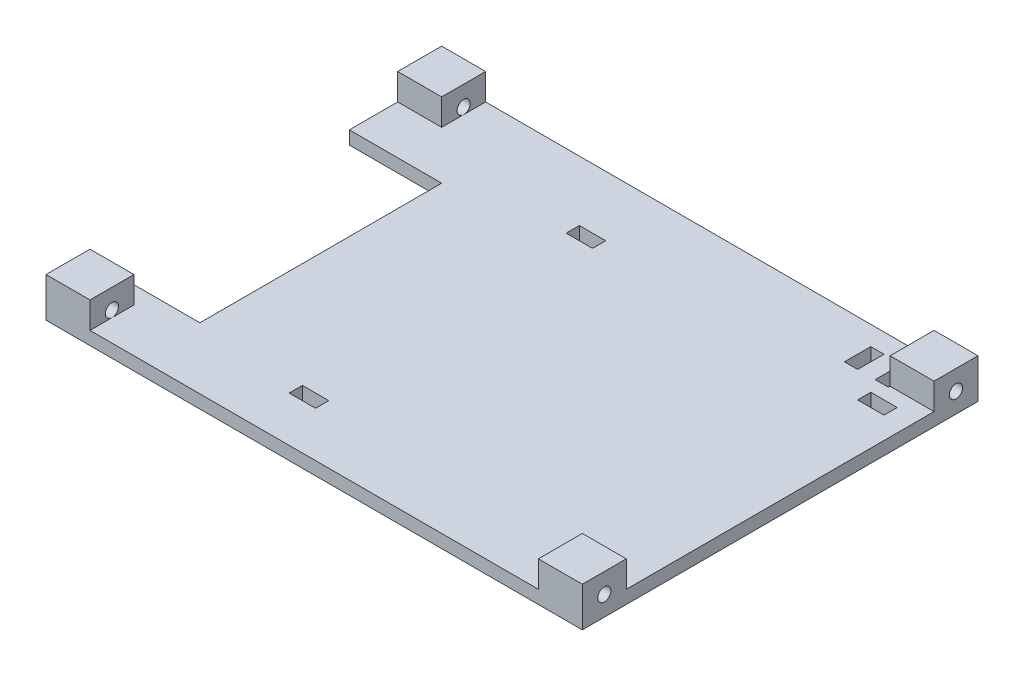
from build123d import *

# Parameters (mm, degrees)
SKETCH1_W           = 122
SKETCH1_H           = 90
BOSS_EXTRUDE1_DEPTH = 3
SKETCH2_W           = 10
SKETCH2_H           = 10
BOSS_EXTRUDE2_DEPTH = 6
CUT_EXTRUDE2_REACH  = 153.872
SKETCH4_R           = 1.5
CUT_EXTRUDE3_REACH  = 153.872
SKETCH5_R           = 1.5
SKETCH7_W           = 6
SKETCH7_H           = 3
SKETCH7_W_2         = 3
SKETCH7_H_2         = 6
SKETCH7_W_3         = 21
SKETCH7_H_3         = 55
CUT_EXTRUDE4_DEPTH  = 152.7234326


with BuildPart() as part:
    # Sketch1 → Boss-Extrude1 (new body)
    with BuildSketch(Plane(origin=(0, 0, 0), x_dir=(1, 0, 0), z_dir=(0, 1, 0))):
        with Locations((61, 45)):
            Rectangle(SKETCH1_W, SKETCH1_H)
    extrude(amount=BOSS_EXTRUDE1_DEPTH)

    # Sketch2 → Boss-Extrude2 (add)
    with BuildSketch(Plane(origin=(0, 3, 0), x_dir=(1, 0, 0), z_dir=(0, 1, 0))):
        Polygon((0, 0), (10, 0), (10, 5.706645394), (10, 10), (7.781127404, 10), (0, 10), align=None)
        with Locations((5, 85)):
            Rectangle(SKETCH2_W, SKETCH2_H)
        with Locations((117, 85)):
            Rectangle(SKETCH2_W, SKETCH2_H)
        with Locations((117, 5)):
            Rectangle(SKETCH2_W, SKETCH2_H)
    extrude(amount=BOSS_EXTRUDE2_DEPTH)

    # Sketch4 → Cut-Extrude2 (cut, up to next)
    with BuildSketch(Plane.ZY, mode=Mode.PRIVATE) as cut_extrude2_sk1:
        with Locations((-85, 4.5)):
            Circle(SKETCH4_R)
    cut_extrude2_tool1 = extrude(cut_extrude2_sk1.sketch, amount=-CUT_EXTRUDE2_REACH, mode=Mode.PRIVATE) & part.part
    # Sketch4 → Cut-Extrude2 (cut, up to next)
    with BuildSketch(Plane.ZY, mode=Mode.PRIVATE) as cut_extrude2_sk2:
        with Locations((-5, 4.5)):
            Circle(SKETCH4_R)
    cut_extrude2_tool2 = extrude(cut_extrude2_sk2.sketch, amount=-CUT_EXTRUDE2_REACH, mode=Mode.PRIVATE) & part.part
    add(cut_extrude2_tool1.solids().sort_by_distance((0, 4.5, -85))[0], mode=Mode.SUBTRACT)
    add(cut_extrude2_tool2.solids().sort_by_distance((0, 4.5, -5))[0], mode=Mode.SUBTRACT)

    # Sketch5 → Cut-Extrude3 (cut, up to next)
    with BuildSketch(Plane(origin=(122, 0, 0), x_dir=(0, 0, -1), z_dir=(1, 0, 0)), mode=Mode.PRIVATE) as cut_extrude3_sk1:
        with Locations(Location((85, 4.5, 0), (0, 0, 180))):
            Circle(SKETCH5_R)
    cut_extrude3_tool1 = extrude(cut_extrude3_sk1.sketch, amount=-CUT_EXTRUDE3_REACH, mode=Mode.PRIVATE) & part.part
    # Sketch5 → Cut-Extrude3 (cut, up to next)
    with BuildSketch(Plane(origin=(122, 0, 0), x_dir=(0, 0, -1), z_dir=(1, 0, 0)), mode=Mode.PRIVATE) as cut_extrude3_sk2:
        with Locations(Location((5, 4.5, 0), (0, 0, 180))):
            Circle(SKETCH5_R)
    cut_extrude3_tool2 = extrude(cut_extrude3_sk2.sketch, amount=-CUT_EXTRUDE3_REACH, mode=Mode.PRIVATE) & part.part
    add(cut_extrude3_tool1.solids().sort_by_distance((122, 4.5, -85))[0], mode=Mode.SUBTRACT)
    add(cut_extrude3_tool2.solids().sort_by_distance((122, 4.5, -5))[0], mode=Mode.SUBTRACT)

    # Sketch7 → Cut-Extrude4 (cut, through all)
    with BuildSketch(Plane(origin=(0, 3, 0), x_dir=(1, 0, 0), z_dir=(0, 1, 0))):
        with Locations((48, 74.815523004)):
            Rectangle(SKETCH7_W, SKETCH7_H)
        with Locations((114, 75.116921084)):
            Rectangle(SKETCH7_W, SKETCH7_H)
        with Locations((48, 11.815523004)):
            Rectangle(SKETCH7_W, SKETCH7_H)
        with Locations((114, 12.116921084)):
            Rectangle(SKETCH7_W, SKETCH7_H)
        with Locations((110.5, 82.616921084)):
            Rectangle(SKETCH7_W_2, SKETCH7_H_2)
        with Locations((103.5, 82.616921084)):
            Rectangle(SKETCH7_W_2, SKETCH7_H_2)
        with Locations((10.5, 41.5)):
            Rectangle(SKETCH7_W_3, SKETCH7_H_3)
    extrude(amount=-CUT_EXTRUDE4_DEPTH, mode=Mode.SUBTRACT)


solid = part.part
